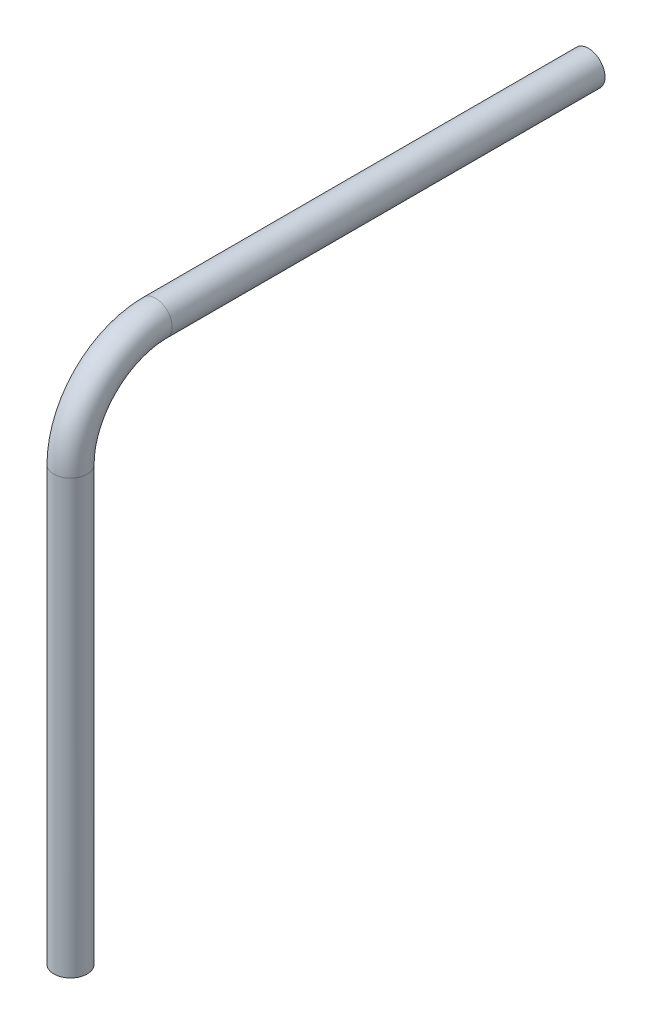
from build123d import *

# Parameters (mm, degrees)
SKETCH3_R           = 12.7
SKETCH4_R           = 12.7
BOSS_EXTRUDE3_DEPTH = 330.2
SKETCH5_R           = 12.7
BOSS_EXTRUDE4_DEPTH = 330.2
SKETCH6_W           = 12.7
SKETCH6_H           = 152.4
CUT_EXTRUDE1_DEPTH  = 6.35


with BuildPart() as part:
    # Sweep1: sweep along a path in Sketch2
    with BuildLine(Plane(origin=(0, 0, 0), x_dir=(0, 0, -1), z_dir=(1, 0, 0))) as sweep1_path:
        ThreePointArc((-64.833774642, 0), (-45.844401699, 45.844401699), (0, 64.833774642))
    # Sketch3 → Sweep1 (sweep)
    with BuildSketch(Plane(origin=(0, 0, 0), x_dir=(1, 0, 0), z_dir=(0, 1, 0))):
        with Locations((0, -64.833774642)):
            Circle(SKETCH3_R)
    sweep(path=sweep1_path.line)

    # Sketch4 → Boss-Extrude3 (add)
    with BuildSketch(Plane(origin=(0, 0, 0), x_dir=(-1, 0, 0), z_dir=(0, -1, 0))):
        with Locations(Location((0, -64.833774642, 0), (0, 0, 90))):
            Circle(SKETCH4_R)
    extrude(amount=BOSS_EXTRUDE3_DEPTH)

    # Sketch5 → Boss-Extrude4 (add)
    with BuildSketch(Plane(origin=(0, 0, 0), x_dir=(-1, 0, 0), z_dir=(0, 0, -1))):
        with Locations(Location((0, 64.833774642, 0), (0, 0, 90))):
            Circle(SKETCH5_R)
    extrude(amount=BOSS_EXTRUDE4_DEPTH)

    # Sketch6 → Cut-Extrude1 (cut)
    with BuildSketch(Plane.ZY.offset(12.7)):
        with Locations((63.5, -76.2)):
            Rectangle(SKETCH6_W, SKETCH6_H)
    extrude(amount=-CUT_EXTRUDE1_DEPTH, mode=Mode.SUBTRACT)


solid = part.part
